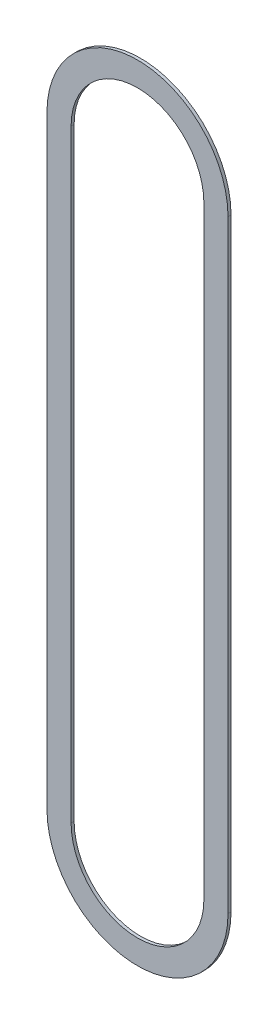
from build123d import *

# Parameters (mm, degrees)
BOSS_EXTRUDE1_DEPTH = 0.5


with BuildPart() as part:
    # Sketch1 → Boss-Extrude1 (new body)
    with BuildSketch(Plane.XY):
        with BuildLine():
            Line((15, 50), (15, -50))
            ThreePointArc((15, -50), (0, -65), (-15, -50))
            Line((-15, -50), (-15, 50))
            ThreePointArc((-15, 50), (0, 65), (15, 50))
        make_face()
        with BuildLine():
            Line((11, 50), (11, -50))
            ThreePointArc((11, -50), (0, -61), (-11, -50))
            Line((-11, -50), (-11, 50))
            ThreePointArc((-11, 50), (0, 61), (11, 50))
        make_face(mode=Mode.SUBTRACT)
    extrude(amount=BOSS_EXTRUDE1_DEPTH)


solid = part.part
